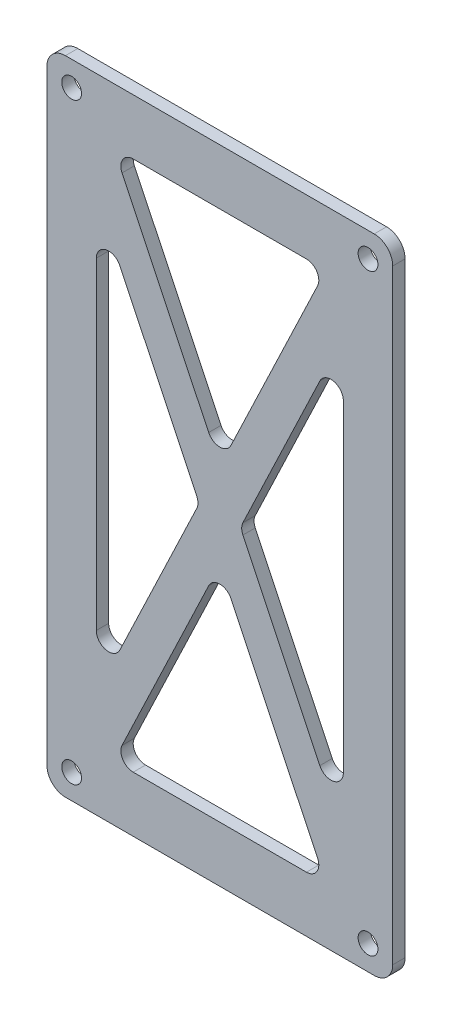
from build123d import *

# Parameters (mm, degrees)
SKETCH_1_W          = 56
SKETCH_1_H          = 104
SKETCH_1_R          = 1.6
EXTRUDE_1_DEPTH     = 2
FILLET_1_R          = 3
CUT_EXTRUDE_1_DEPTH = 10
FILLET_2_R          = 2


with BuildPart() as part:
    # 草图1 → 凸台-拉伸1 (new body)
    with BuildSketch(Plane.XY):
        Rectangle(SKETCH_1_W, SKETCH_1_H)
        with Locations((-24, 48)):
            Circle(SKETCH_1_R, mode=Mode.SUBTRACT)
        with Locations((-24, -48)):
            Circle(SKETCH_1_R, mode=Mode.SUBTRACT)
        with Locations(Location((24, -48, 0), (0, 0, 180))):
            Circle(SKETCH_1_R, mode=Mode.SUBTRACT)
        with Locations(Location((24, 48, 0), (0, 0, 180))):
            Circle(SKETCH_1_R, mode=Mode.SUBTRACT)
    extrude(amount=EXTRUDE_1_DEPTH)

    # 圆角1
    fillet_1_edges = [part.edges().sort_by_distance(p)[0] for p in [
        (28, -52, 1),
        (-28, -52, 1),
        (-28, 52, 1),
        (28, 52, 1),
    ]]
    fillet(fillet_1_edges, radius=FILLET_1_R)

    # 草图2 → 切除-拉伸1 (cut)
    with BuildSketch(Plane.XY.offset(2)):
        Polygon((-20, 34.939835194), (-20, -34.939835194), (-3.324169566, 0), align=None)
        Polygon((-17.198557706, -43), (17.198557706, -43), (0, -6.96492671), align=None)
        Polygon((0, 6.96492671), (-17.198557706, 43), (17.198557706, 43), align=None)
        Polygon((3.324169566, 0), (20, 34.939835194), (20, -34.939835194), align=None)
    extrude(amount=-CUT_EXTRUDE_1_DEPTH, mode=Mode.SUBTRACT)

    # 圆角2
    fillet_2_edges = [part.edges().sort_by_distance(p)[0] for p in [
        (-3.324169566, 0, 1),
        (-20, -34.939835194, 1),
        (-20, 34.939835194, 1),
        (-17.198557706, -43, 1),
        (0, -6.96492671, 1),
        (17.198557706, -43, 1),
        (17.198557706, 43, 1),
        (0, 6.96492671, 1),
        (-17.198557706, 43, 1),
        (20, -34.939835194, 1),
        (3.324169566, 0, 1),
        (20, 34.939835194, 1),
    ]]
    fillet(fillet_2_edges, radius=FILLET_2_R)


solid = part.part
